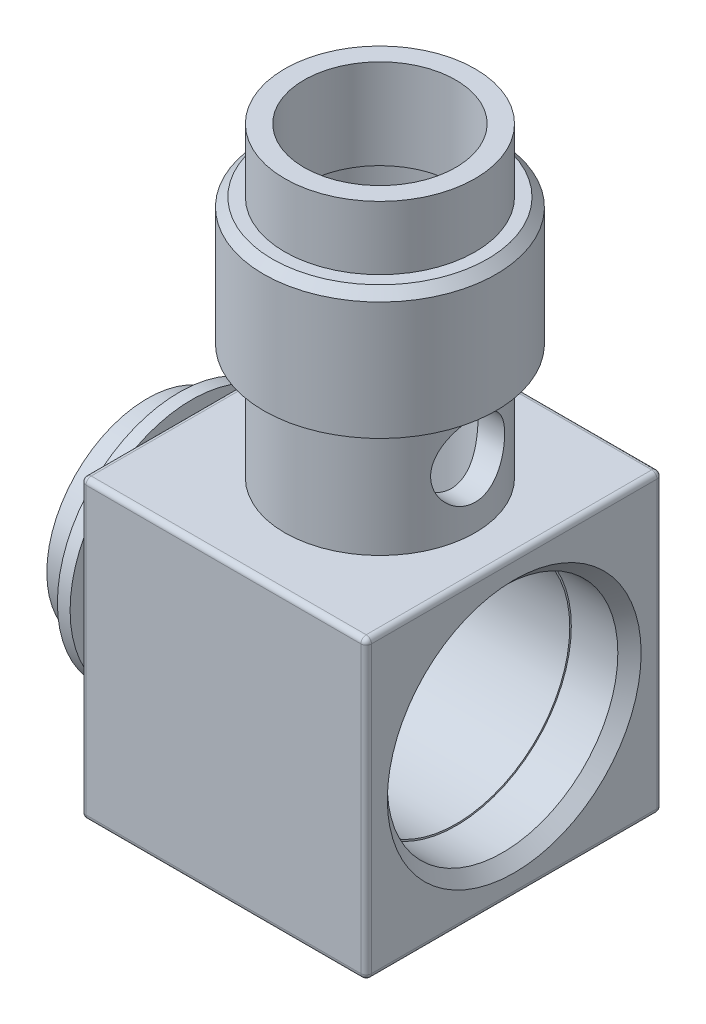
from build123d import *

# Parameters (mm, degrees)
SKETCH_2_R               = 9
EXTRUDE_1_DEPTH          = 25
SKETCH_3_R               = 11
EXTRUDE_2_DEPTH          = 12
SKETCH_4_R               = 9
EXTRUDE_3_DEPTH          = 6
SKETCH_5_R               = 10.75
CUT_EXTRUDE_1_DEPTH      = 23.1
CUT_EXTRUDE_START        = -8.5
SKETCH_6_R               = 8.5
CUT_EXTRUDE_2_DEPTH      = 7
CUT_EXTRUDE_3_REACH      = 57.878
CUT_EXTRUDE_3_END_RADIUS = 10.75
SKETCH_8_R               = 6.75
SKETCH_9_R               = 3.5
CUT_EXTRUDE_4_DEPTH      = 58.000789554
SKETCH_10_R              = 10.75
EXTRUDE_4_DEPTH          = 5.95
CHAMFER_1_SIZE           = 0.828
SKETCH_12_W              = 28
SKETCH_12_H              = 28
SKETCH_12_R              = 13
EXTRUDE_5_DEPTH          = 27
CUT_EXTRUDE_5_REACH      = 49.34
SKETCH_13_R              = 6.75
CUT_EXTRUDE_6_REACH      = 70.184
SKETCH_14_R              = 7.172
SKETCH_16_R              = 10.8985
CUT_EXTRUDE_7_DEPTH      = 5.5
CHAMFER_3_SIZE           = 1.1015
CUT_EXTRUDE_11_REACH     = 55.587
SKETCH_18_R              = 10.75
FILLET_1_R               = 0.5


with BuildPart() as part:
    # Эскиз1 → Повернуть1 (revolve)
    with BuildSketch(Plane.XY, mode=Mode.PRIVATE) as revolve_1_sk:
        Polygon((0, -7), (11.6, -7), (11.6, 0), (34.7, 0), (34.7, -10.5), (34.7, -14), (7.7, -14), (7.7, -9.5), (4.2, -9.5), (4.2, -11.5), (3, -11.5), (3, -9.5), (0, -9.5), align=None)
    revolve(revolve_1_sk.sketch.rotate(Axis((0, 0, 0), (1, 0, 0)), 270), axis=Axis((0, 0, 0), (1, 0, 0)))

    # Эскиз2 → Бобышка-Вытянуть1 (add)
    with BuildSketch(Plane(origin=(0, 0, 0), x_dir=(1, 0, 0), z_dir=(0, 1, 0))):
        with Locations(Location((22, 0, 0), (0, 0, 90))):
            Circle(SKETCH_2_R)
    extrude(amount=EXTRUDE_1_DEPTH)

    # Эскиз3 → Бобышка-Вытянуть2 (add)
    with BuildSketch(Plane(origin=(0, 25, 0), x_dir=(1, 0, 0), z_dir=(0, 1, 0))):
        with Locations(Location((22, 0, 0), (0, 0, 270))):
            Circle(SKETCH_3_R)
    extrude(amount=EXTRUDE_2_DEPTH)

    # Эскиз4 → Бобышка-Вытянуть3 (add)
    with BuildSketch(Plane(origin=(0, 37, 0), x_dir=(1, 0, 0), z_dir=(0, 1, 0))):
        with Locations(Location((22, 0, 0), (0, 0, 90))):
            Circle(SKETCH_4_R)
    extrude(amount=EXTRUDE_3_DEPTH)

    # Эскиз5 → Вырез-Вытянуть1 (cut)
    with BuildSketch(Plane(origin=(34.7, 0, 0), x_dir=(0, 0, -1), z_dir=(1, 0, 0))):
        Circle(SKETCH_5_R)
    extrude(amount=-CUT_EXTRUDE_1_DEPTH, mode=Mode.SUBTRACT)

    # Эскиз6 → Вырез-Вытянуть2 (cut)
    with BuildSketch(Plane(origin=(0, 43, 0), x_dir=(1, 0, 0), z_dir=(0, 1, 0)).offset(CUT_EXTRUDE_START)):
        with Locations(Location((22, 0, 0), (0, 0, 270))):
            Circle(SKETCH_6_R)
    extrude(amount=-CUT_EXTRUDE_2_DEPTH, mode=Mode.SUBTRACT)

    # Вырез-Вытянуть3: up to this cylinder (the profile starts outside it)
    cut_extrude_3_end = Plane(origin=(22, 0, 0), z_dir=(1, 0, 0)) * Cylinder(CUT_EXTRUDE_3_END_RADIUS, 138.256, mode=Mode.PRIVATE)
    # Эскиз8 → Вырез-Вытянуть3 (cut, up to the surface)
    with BuildSketch(Plane(origin=(0, 27.5, 0), x_dir=(1, 0, 0), z_dir=(0, 1, 0)), mode=Mode.PRIVATE) as cut_extrude_3_sk1:
        with Locations(Location((22, 0, 0), (0, 0, 270))):
            Circle(SKETCH_8_R)
    cut_extrude_3_tool1 = extrude(cut_extrude_3_sk1.sketch, amount=-CUT_EXTRUDE_3_REACH, mode=Mode.PRIVATE) - cut_extrude_3_end
    add(cut_extrude_3_tool1.solids().sort_by_distance((22, 27.5, 0))[0], mode=Mode.SUBTRACT)

    # Эскиз9 → Вырез-Вытянуть4 (cut, through all)
    with BuildSketch(Plane(origin=(0, 0, 0), x_dir=(0, 0, -1), z_dir=(1, 0, 0))):
        with Locations(Location((0, 20, 0), (0, 0, 180))):
            Circle(SKETCH_9_R)
    extrude(amount=CUT_EXTRUDE_4_DEPTH, mode=Mode.SUBTRACT)

    # Эскиз10 → Бобышка-Вытянуть4 (add)
    with BuildSketch(Plane(origin=(34.7, 0, 0), x_dir=(0, 0, -1), z_dir=(1, 0, 0))):
        with Locations(Location((0, 0, 0), (0, 0, 90))):
            Circle(SKETCH_10_R)
    extrude(amount=-EXTRUDE_4_DEPTH)

    # Фаска1
    chamfer_1_edges = [part.edges().sort_by_distance(p)[0] for p in [
        (22, 37, -11),
    ]]
    chamfer(chamfer_1_edges, length=CHAMFER_1_SIZE)

    # Эскиз12 → Бобышка-Вытянуть5 (add)
    with BuildSketch(Plane(origin=(34.7, 0, 0), x_dir=(0, 0, -1), z_dir=(1, 0, 0))):
        Rectangle(SKETCH_12_W, SKETCH_12_H)
        Circle(SKETCH_12_R, mode=Mode.SUBTRACT)
    extrude(amount=-EXTRUDE_5_DEPTH)

    # Эскиз13 → Вырез-Вытянуть5 (cut, up to next)
    with BuildSketch(Plane(origin=(0, 14, 0), x_dir=(1, 0, 0), z_dir=(0, 1, 0)), mode=Mode.PRIVATE) as cut_extrude_5_sk1:
        with Locations(Location((22, 0, 0), (0, 0, 270))):
            Circle(SKETCH_13_R)
    cut_extrude_5_tool1 = extrude(cut_extrude_5_sk1.sketch, amount=-CUT_EXTRUDE_5_REACH, mode=Mode.PRIVATE) & part.part
    add(cut_extrude_5_tool1.solids().sort_by_distance((22, 14, 0))[0], mode=Mode.SUBTRACT)

    # Эскиз14 → Вырез-Вытянуть6 (cut, up to next)
    with BuildSketch(Plane(origin=(0, 43, 0), x_dir=(1, 0, 0), z_dir=(0, 1, 0)), mode=Mode.PRIVATE) as cut_extrude_6_sk1:
        with Locations(Location((22, 0, 0), (0, 0, 270))):
            Circle(SKETCH_14_R)
    cut_extrude_6_tool1 = extrude(cut_extrude_6_sk1.sketch, amount=-CUT_EXTRUDE_6_REACH, mode=Mode.PRIVATE) & part.part
    add(cut_extrude_6_tool1.solids().sort_by_distance((22, 43, 0))[0], mode=Mode.SUBTRACT)

    # Эскиз16 → Вырез-Вытянуть7 (cut)
    with BuildSketch(Plane(origin=(34.7, 0, 0), x_dir=(0, 0, -1), z_dir=(1, 0, 0))):
        Circle(SKETCH_16_R)
    extrude(amount=-CUT_EXTRUDE_7_DEPTH, mode=Mode.SUBTRACT)

    # Фаска3
    chamfer_3_edges = [part.edges().sort_by_distance(p)[0] for p in [
        (34.7, 0, 10.8985),
    ]]
    chamfer(chamfer_3_edges, length=CHAMFER_3_SIZE)

    # Эскиз18 → Вырез-Вытянуть11 (cut, up to next)
    with BuildSketch(Plane.ZY.offset(-28.75), mode=Mode.PRIVATE) as cut_extrude_11_sk1:
        with Locations(Location((0, 0, 0), (0, 0, 180))):
            Circle(SKETCH_18_R)
    cut_extrude_11_tool1 = extrude(cut_extrude_11_sk1.sketch, amount=-CUT_EXTRUDE_11_REACH, mode=Mode.PRIVATE) & part.part
    add(cut_extrude_11_tool1.solids().sort_by_distance((28.75, 0, 0))[0], mode=Mode.SUBTRACT)

    # Скругление1
    fillet_1_edges = [part.edges().sort_by_distance(p)[0] for p in [
        (34.7, 0, 14),
        (34.7, -14, 0),
        (34.7, 0, -14),
        (34.7, 14, 0),
        (7.7, 0, -14),
        (21.2, 14, -14),
        (7.7, -14, 0),
        (21.2, -14, -14),
        (7.7, 0, 14),
        (21.2, -14, 14),
        (7.7, 14, 0),
        (21.2, 14, 14),
    ]]
    fillet(fillet_1_edges, radius=FILLET_1_R)


solid = part.part
